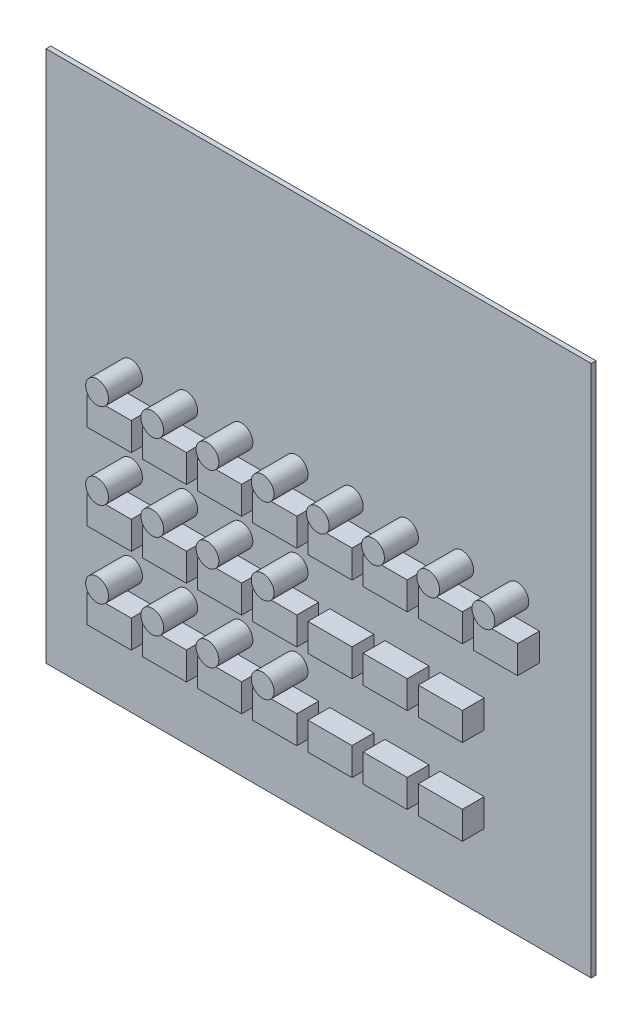
from build123d import *

# Parameters (mm, degrees)
SKETCH1_W                       = 182.118
SKETCH1_H                       = 177.8
BOARD_DEPTH                     = 1.592072
SKETCH2_R                       = 3.81
LED_KINGBRIGHT_3P_2P54_1_DEPTH  = 11.3538
SKETCH3_R                       = 3.81
LED_KINGBRIGHT_3P_2P54_2_DEPTH  = 11.3538
SKETCH4_R                       = 3.81
LED_KINGBRIGHT_3P_2P54_3_DEPTH  = 11.3538
SKETCH5_R                       = 3.81
LED_KINGBRIGHT_3P_2P54_4_DEPTH  = 11.3538
SKETCH6_R                       = 3.81
LED_KINGBRIGHT_3P_2P54_5_DEPTH  = 11.3538
SKETCH7_R                       = 3.81
LED_KINGBRIGHT_3P_2P54_6_DEPTH  = 11.3538
SKETCH8_R                       = 3.81
LED_KINGBRIGHT_3P_2P54_7_DEPTH  = 11.3538
SKETCH9_R                       = 3.81
LED_KINGBRIGHT_3P_2P54_8_DEPTH  = 11.3538
SKETCH10_R                      = 3.81
LED_KINGBRIGHT_3P_2P54_9_DEPTH  = 11.3538
SKETCH11_R                      = 3.81
LED_KINGBRIGHT_3P_2P54_10_DEPTH = 11.3538
SKETCH12_R                      = 3.81
LED_KINGBRIGHT_3P_2P54_11_DEPTH = 11.3538
SKETCH13_R                      = 3.81
LED_KINGBRIGHT_3P_2P54_12_DEPTH = 11.3538
SKETCH14_R                      = 3.81
LED_KINGBRIGHT_3P_2P54_13_DEPTH = 11.3538
SKETCH15_R                      = 3.81
LED_KINGBRIGHT_3P_2P54_14_DEPTH = 11.3538
SKETCH16_R                      = 3.81
LED_KINGBRIGHT_3P_2P54_15_DEPTH = 11.3538
SKETCH17_R                      = 3.81
LED_KINGBRIGHT_3P_2P54_16_DEPTH = 11.3538
SKETCH18_W                      = 14.732
SKETCH18_H                      = 9.271
SWITCH_MCDTS2_1_DEPTH           = 7.3000108
SKETCH19_W                      = 14.732
SKETCH19_H                      = 9.271
SWITCH_MCDTS2_2_DEPTH           = 7.3000108
SKETCH20_W                      = 14.732
SKETCH20_H                      = 9.271
SWITCH_MCDTS2_3_DEPTH           = 7.3000108
SKETCH21_W                      = 14.732
SKETCH21_H                      = 9.271
SWITCH_MCDTS2_4_DEPTH           = 7.3000108
SKETCH22_W                      = 14.732
SKETCH22_H                      = 9.271
SWITCH_MCDTS2_5_DEPTH           = 7.3000108
SKETCH23_W                      = 14.732
SKETCH23_H                      = 9.271
SWITCH_MCDTS2_6_DEPTH           = 7.3000108
SKETCH24_W                      = 14.732
SKETCH24_H                      = 9.271
SWITCH_MCDTS2_7_DEPTH           = 7.3000108
SKETCH25_W                      = 14.732
SKETCH25_H                      = 9.271
SWITCH_MCDTS2_8_DEPTH           = 7.3000108
SKETCH26_W                      = 14.732
SKETCH26_H                      = 9.271
SWITCH_MCDTS2_9_DEPTH           = 7.3000108
SKETCH27_W                      = 14.732
SKETCH27_H                      = 9.271
SWITCH_MCDTS2_10_DEPTH          = 7.3000108
SKETCH28_W                      = 14.732
SKETCH28_H                      = 9.271
SWITCH_MCDTS2_11_DEPTH          = 7.3000108
SKETCH29_W                      = 14.732
SKETCH29_H                      = 9.271
SWITCH_MCDTS2_12_DEPTH          = 7.3000108
SKETCH30_W                      = 14.732
SKETCH30_H                      = 9.271
SWITCH_MCDTS2_13_DEPTH          = 7.3000108
SKETCH31_W                      = 14.732
SKETCH31_H                      = 9.271
SWITCH_MCDTS2_14_DEPTH          = 7.3000108
SKETCH32_W                      = 14.732
SKETCH32_H                      = 9.271
SWITCH_MCDTS2_15_DEPTH          = 7.3000108
SKETCH33_W                      = 14.732
SKETCH33_H                      = 9.271
SWITCH_MCDTS2_16_DEPTH          = 7.3000108
SKETCH34_W                      = 14.732
SKETCH34_H                      = 9.271
SWITCH_MCDTS2_17_DEPTH          = 7.3000108
SKETCH35_W                      = 14.732
SKETCH35_H                      = 9.271
SWITCH_MCDTS2_18_DEPTH          = 7.3000108
SKETCH36_W                      = 14.732
SKETCH36_H                      = 9.271
SWITCH_MCDTS2_19_DEPTH          = 7.3000108
SKETCH37_W                      = 14.732
SKETCH37_H                      = 9.271
SWITCH_MCDTS2_20_DEPTH          = 7.3000108
SKETCH38_W                      = 14.732
SKETCH38_H                      = 9.271
SWITCH_MCDTS2_21_DEPTH          = 7.3000108
SKETCH39_W                      = 14.732
SKETCH39_H                      = 9.271
SWITCH_MCDTS2_22_DEPTH          = 7.3000108


with BuildPart() as part:
    # Sketch1 → BOARD (new body)
    with BuildSketch(Plane.XY):
        with Locations((91.059, 88.9)):
            Rectangle(SKETCH1_W, SKETCH1_H)
    extrude(amount=BOARD_DEPTH)


with BuildPart() as body_2:
    # Sketch2 → LED-KINGBRIGHT_3P_2P54-1 (new body)
    with BuildSketch(Plane.XY.offset(1.592072)):
        with Locations((83.7097132, 41.1988)):
            Circle(SKETCH2_R)
    extrude(amount=LED_KINGBRIGHT_3P_2P54_1_DEPTH)


with BuildPart() as body_3:
    # Sketch3 → LED-KINGBRIGHT_3P_2P54-2 (new body)
    with BuildSketch(Plane.XY.offset(1.592072)):
        with Locations((65.2722088, 41.1988)):
            Circle(SKETCH3_R)
    extrude(amount=LED_KINGBRIGHT_3P_2P54_2_DEPTH)


with BuildPart() as body_4:
    # Sketch4 → LED-KINGBRIGHT_3P_2P54-3 (new body)
    with BuildSketch(Plane.XY.offset(1.592072)):
        with Locations((46.8347044, 41.1988)):
            Circle(SKETCH4_R)
    extrude(amount=LED_KINGBRIGHT_3P_2P54_3_DEPTH)


with BuildPart() as body_5:
    # Sketch5 → LED-KINGBRIGHT_3P_2P54-4 (new body)
    with BuildSketch(Plane.XY.offset(1.592072)):
        with Locations((28.3972, 41.1988)):
            Circle(SKETCH5_R)
    extrude(amount=LED_KINGBRIGHT_3P_2P54_4_DEPTH)


with BuildPart() as body_6:
    # Sketch6 → LED-KINGBRIGHT_3P_2P54-5 (new body)
    with BuildSketch(Plane.XY.offset(1.592072)):
        with Locations((83.7097132, 69.7738)):
            Circle(SKETCH6_R)
    extrude(amount=LED_KINGBRIGHT_3P_2P54_5_DEPTH)


with BuildPart() as body_7:
    # Sketch7 → LED-KINGBRIGHT_3P_2P54-6 (new body)
    with BuildSketch(Plane.XY.offset(1.592072)):
        with Locations((65.2722088, 69.7738)):
            Circle(SKETCH7_R)
    extrude(amount=LED_KINGBRIGHT_3P_2P54_6_DEPTH)


with BuildPart() as body_8:
    # Sketch8 → LED-KINGBRIGHT_3P_2P54-7 (new body)
    with BuildSketch(Plane.XY.offset(1.592072)):
        with Locations((46.8347044, 69.7738)):
            Circle(SKETCH8_R)
    extrude(amount=LED_KINGBRIGHT_3P_2P54_7_DEPTH)


with BuildPart() as body_9:
    # Sketch9 → LED-KINGBRIGHT_3P_2P54-8 (new body)
    with BuildSketch(Plane.XY.offset(1.592072)):
        with Locations((28.3972, 69.7738)):
            Circle(SKETCH9_R)
    extrude(amount=LED_KINGBRIGHT_3P_2P54_8_DEPTH)


with BuildPart() as body_10:
    # Sketch10 → LED-KINGBRIGHT_3P_2P54-9 (new body)
    with BuildSketch(Plane.XY.offset(1.592072)):
        with Locations((157.4597308, 98.3488)):
            Circle(SKETCH10_R)
    extrude(amount=LED_KINGBRIGHT_3P_2P54_9_DEPTH)


with BuildPart() as body_11:
    # Sketch11 → LED-KINGBRIGHT_3P_2P54-10 (new body)
    with BuildSketch(Plane.XY.offset(1.592072)):
        with Locations((139.0222264, 98.3488)):
            Circle(SKETCH11_R)
    extrude(amount=LED_KINGBRIGHT_3P_2P54_10_DEPTH)


with BuildPart() as body_12:
    # Sketch12 → LED-KINGBRIGHT_3P_2P54-11 (new body)
    with BuildSketch(Plane.XY.offset(1.592072)):
        with Locations((120.584722, 98.3488)):
            Circle(SKETCH12_R)
    extrude(amount=LED_KINGBRIGHT_3P_2P54_11_DEPTH)


with BuildPart() as body_13:
    # Sketch13 → LED-KINGBRIGHT_3P_2P54-12 (new body)
    with BuildSketch(Plane.XY.offset(1.592072)):
        with Locations((102.1472176, 98.3488)):
            Circle(SKETCH13_R)
    extrude(amount=LED_KINGBRIGHT_3P_2P54_12_DEPTH)


with BuildPart() as body_14:
    # Sketch14 → LED-KINGBRIGHT_3P_2P54-13 (new body)
    with BuildSketch(Plane.XY.offset(1.592072)):
        with Locations((83.7097132, 98.3488)):
            Circle(SKETCH14_R)
    extrude(amount=LED_KINGBRIGHT_3P_2P54_13_DEPTH)


with BuildPart() as body_15:
    # Sketch15 → LED-KINGBRIGHT_3P_2P54-14 (new body)
    with BuildSketch(Plane.XY.offset(1.592072)):
        with Locations((65.2722088, 98.3488)):
            Circle(SKETCH15_R)
    extrude(amount=LED_KINGBRIGHT_3P_2P54_14_DEPTH)


with BuildPart() as body_16:
    # Sketch16 → LED-KINGBRIGHT_3P_2P54-15 (new body)
    with BuildSketch(Plane.XY.offset(1.592072)):
        with Locations((46.8347044, 98.3488)):
            Circle(SKETCH16_R)
    extrude(amount=LED_KINGBRIGHT_3P_2P54_15_DEPTH)


with BuildPart() as body_17:
    # Sketch17 → LED-KINGBRIGHT_3P_2P54-16 (new body)
    with BuildSketch(Plane.XY.offset(1.592072)):
        with Locations((28.3972, 98.3488)):
            Circle(SKETCH17_R)
    extrude(amount=LED_KINGBRIGHT_3P_2P54_16_DEPTH)


with BuildPart() as body_18:
    # Sketch18 → SWITCH-MCDTS2-1 (new body)
    with BuildSketch(Plane.XY.offset(1.592072)):
        with Locations((139.0222264, 29.9593)):
            Rectangle(SKETCH18_W, SKETCH18_H)
    extrude(amount=SWITCH_MCDTS2_1_DEPTH)


with BuildPart() as body_19:
    # Sketch19 → SWITCH-MCDTS2-2 (new body)
    with BuildSketch(Plane.XY.offset(1.592072)):
        with Locations((120.584722, 29.9593)):
            Rectangle(SKETCH19_W, SKETCH19_H)
    extrude(amount=SWITCH_MCDTS2_2_DEPTH)


with BuildPart() as body_20:
    # Sketch20 → SWITCH-MCDTS2-3 (new body)
    with BuildSketch(Plane.XY.offset(1.592072)):
        with Locations((102.1472176, 29.9593)):
            Rectangle(SKETCH20_W, SKETCH20_H)
    extrude(amount=SWITCH_MCDTS2_3_DEPTH)


with BuildPart() as body_21:
    # Sketch21 → SWITCH-MCDTS2-4 (new body)
    with BuildSketch(Plane.XY.offset(1.592072)):
        with Locations((83.7097132, 29.9593)):
            Rectangle(SKETCH21_W, SKETCH21_H)
    extrude(amount=SWITCH_MCDTS2_4_DEPTH)


with BuildPart() as body_22:
    # Sketch22 → SWITCH-MCDTS2-5 (new body)
    with BuildSketch(Plane.XY.offset(1.592072)):
        with Locations((65.2722088, 29.9593)):
            Rectangle(SKETCH22_W, SKETCH22_H)
    extrude(amount=SWITCH_MCDTS2_5_DEPTH)


with BuildPart() as body_23:
    # Sketch23 → SWITCH-MCDTS2-6 (new body)
    with BuildSketch(Plane.XY.offset(1.592072)):
        with Locations((46.8347044, 29.9593)):
            Rectangle(SKETCH23_W, SKETCH23_H)
    extrude(amount=SWITCH_MCDTS2_6_DEPTH)


with BuildPart() as body_24:
    # Sketch24 → SWITCH-MCDTS2-7 (new body)
    with BuildSketch(Plane.XY.offset(1.592072)):
        with Locations((28.3972, 29.9593)):
            Rectangle(SKETCH24_W, SKETCH24_H)
    extrude(amount=SWITCH_MCDTS2_7_DEPTH)


with BuildPart() as body_25:
    # Sketch25 → SWITCH-MCDTS2-8 (new body)
    with BuildSketch(Plane.XY.offset(1.592072)):
        with Locations((139.0222264, 58.5343)):
            Rectangle(SKETCH25_W, SKETCH25_H)
    extrude(amount=SWITCH_MCDTS2_8_DEPTH)


with BuildPart() as body_26:
    # Sketch26 → SWITCH-MCDTS2-9 (new body)
    with BuildSketch(Plane.XY.offset(1.592072)):
        with Locations((120.584722, 58.5343)):
            Rectangle(SKETCH26_W, SKETCH26_H)
    extrude(amount=SWITCH_MCDTS2_9_DEPTH)


with BuildPart() as body_27:
    # Sketch27 → SWITCH-MCDTS2-10 (new body)
    with BuildSketch(Plane.XY.offset(1.592072)):
        with Locations((102.1472176, 58.5343)):
            Rectangle(SKETCH27_W, SKETCH27_H)
    extrude(amount=SWITCH_MCDTS2_10_DEPTH)


with BuildPart() as body_28:
    # Sketch28 → SWITCH-MCDTS2-11 (new body)
    with BuildSketch(Plane.XY.offset(1.592072)):
        with Locations((83.7097132, 58.5343)):
            Rectangle(SKETCH28_W, SKETCH28_H)
    extrude(amount=SWITCH_MCDTS2_11_DEPTH)


with BuildPart() as body_29:
    # Sketch29 → SWITCH-MCDTS2-12 (new body)
    with BuildSketch(Plane.XY.offset(1.592072)):
        with Locations((65.2722088, 58.5343)):
            Rectangle(SKETCH29_W, SKETCH29_H)
    extrude(amount=SWITCH_MCDTS2_12_DEPTH)


with BuildPart() as body_30:
    # Sketch30 → SWITCH-MCDTS2-13 (new body)
    with BuildSketch(Plane.XY.offset(1.592072)):
        with Locations((46.8347044, 58.5343)):
            Rectangle(SKETCH30_W, SKETCH30_H)
    extrude(amount=SWITCH_MCDTS2_13_DEPTH)


with BuildPart() as body_31:
    # Sketch31 → SWITCH-MCDTS2-14 (new body)
    with BuildSketch(Plane.XY.offset(1.592072)):
        with Locations((28.3972, 58.5343)):
            Rectangle(SKETCH31_W, SKETCH31_H)
    extrude(amount=SWITCH_MCDTS2_14_DEPTH)


with BuildPart() as body_32:
    # Sketch32 → SWITCH-MCDTS2-15 (new body)
    with BuildSketch(Plane.XY.offset(1.592072)):
        with Locations((157.4597308, 87.1093)):
            Rectangle(SKETCH32_W, SKETCH32_H)
    extrude(amount=SWITCH_MCDTS2_15_DEPTH)


with BuildPart() as body_33:
    # Sketch33 → SWITCH-MCDTS2-16 (new body)
    with BuildSketch(Plane.XY.offset(1.592072)):
        with Locations((139.0222264, 87.1093)):
            Rectangle(SKETCH33_W, SKETCH33_H)
    extrude(amount=SWITCH_MCDTS2_16_DEPTH)


with BuildPart() as body_34:
    # Sketch34 → SWITCH-MCDTS2-17 (new body)
    with BuildSketch(Plane.XY.offset(1.592072)):
        with Locations((120.584722, 87.1093)):
            Rectangle(SKETCH34_W, SKETCH34_H)
    extrude(amount=SWITCH_MCDTS2_17_DEPTH)


with BuildPart() as body_35:
    # Sketch35 → SWITCH-MCDTS2-18 (new body)
    with BuildSketch(Plane.XY.offset(1.592072)):
        with Locations((102.1472176, 87.1093)):
            Rectangle(SKETCH35_W, SKETCH35_H)
    extrude(amount=SWITCH_MCDTS2_18_DEPTH)


with BuildPart() as body_36:
    # Sketch36 → SWITCH-MCDTS2-19 (new body)
    with BuildSketch(Plane.XY.offset(1.592072)):
        with Locations((83.7097132, 87.1093)):
            Rectangle(SKETCH36_W, SKETCH36_H)
    extrude(amount=SWITCH_MCDTS2_19_DEPTH)


with BuildPart() as body_37:
    # Sketch37 → SWITCH-MCDTS2-20 (new body)
    with BuildSketch(Plane.XY.offset(1.592072)):
        with Locations((65.2722088, 87.1093)):
            Rectangle(SKETCH37_W, SKETCH37_H)
    extrude(amount=SWITCH_MCDTS2_20_DEPTH)


with BuildPart() as body_38:
    # Sketch38 → SWITCH-MCDTS2-21 (new body)
    with BuildSketch(Plane.XY.offset(1.592072)):
        with Locations((46.8347044, 87.1093)):
            Rectangle(SKETCH38_W, SKETCH38_H)
    extrude(amount=SWITCH_MCDTS2_21_DEPTH)


with BuildPart() as body_39:
    # Sketch39 → SWITCH-MCDTS2-22 (new body)
    with BuildSketch(Plane.XY.offset(1.592072)):
        with Locations((28.3972, 87.1093)):
            Rectangle(SKETCH39_W, SKETCH39_H)
    extrude(amount=SWITCH_MCDTS2_22_DEPTH)


solid = Compound([part.part, body_2.part, body_3.part, body_4.part, body_5.part, body_6.part, body_7.part, body_8.part, body_9.part, body_10.part, body_11.part, body_12.part, body_13.part, body_14.part, body_15.part, body_16.part, body_17.part, body_18.part, body_19.part, body_20.part, body_21.part, body_22.part, body_23.part, body_24.part, body_25.part, body_26.part, body_27.part, body_28.part, body_29.part, body_30.part, body_31.part, body_32.part, body_33.part, body_34.part, body_35.part, body_36.part, body_37.part, body_38.part, body_39.part])
